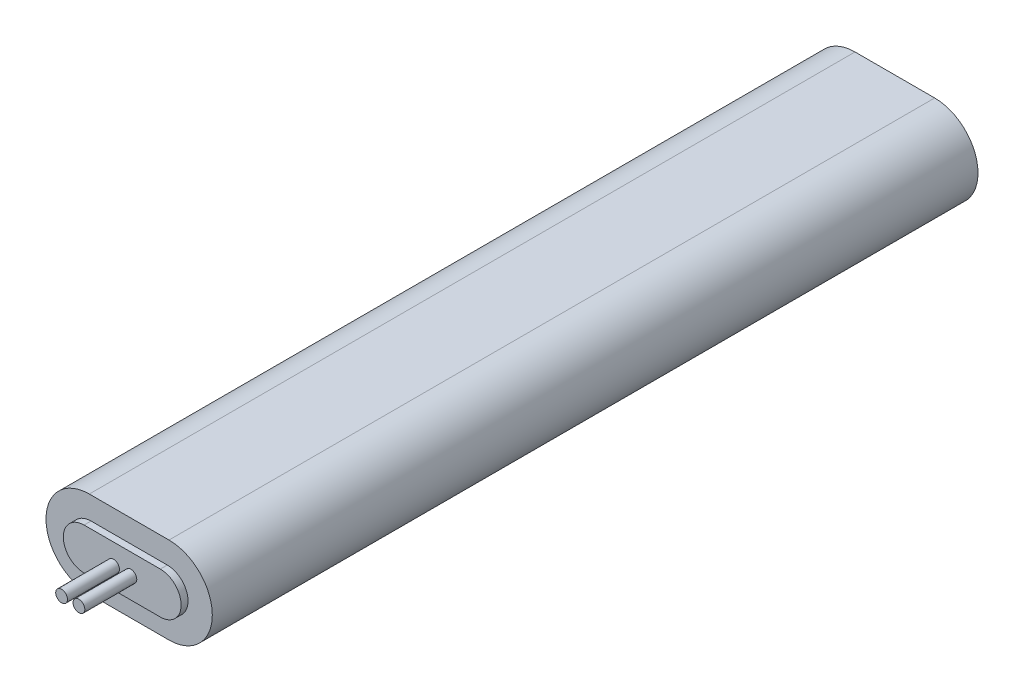
from build123d import *

# Parameters (mm, degrees)
BOSS_EXTRU_1_DEPTH = 110.5
BOSS_EXTRU_2_DEPTH = 2
ESQUISSE3_R        = 1.7
BOSS_EXTRU_3_DEPTH = 15


with BuildPart() as part:
    # Esquisse1 → Boss.-Extru.1 (new, symmetric)
    with BuildSketch(Plane.XY):
        with BuildLine():
            Line((-11.5, 12.5), (11.5, 12.5))
            ThreePointArc((11.5, 12.5), (24, 0), (11.5, -12.5))
            Line((11.5, -12.5), (-11.5, -12.5))
            ThreePointArc((-11.5, -12.5), (-24, 0), (-11.5, 12.5))
        make_face()
    extrude(amount=BOSS_EXTRU_1_DEPTH, both=True)

    # Esquisse2 → Boss.-Extru.2 (add)
    with BuildSketch(Plane.XY.offset(110.5)):
        with BuildLine():
            Line((-11, 6), (11, 6))
            ThreePointArc((11, 6), (17, 0), (11, -6))
            Line((11, -6), (-11, -6))
            ThreePointArc((-11, -6), (-17, 0), (-11, 6))
        make_face()
    extrude(amount=BOSS_EXTRU_2_DEPTH)

    # Esquisse3 → Boss.-Extru.3 (add)
    with BuildSketch(Plane.XY.offset(112.5)):
        with Locations((2.5, 0)):
            Circle(ESQUISSE3_R)
        with Locations(Location((-2.5, 0, 0), (0, 0, 180))):
            Circle(ESQUISSE3_R)
    extrude(amount=BOSS_EXTRU_3_DEPTH)


solid = part.part
